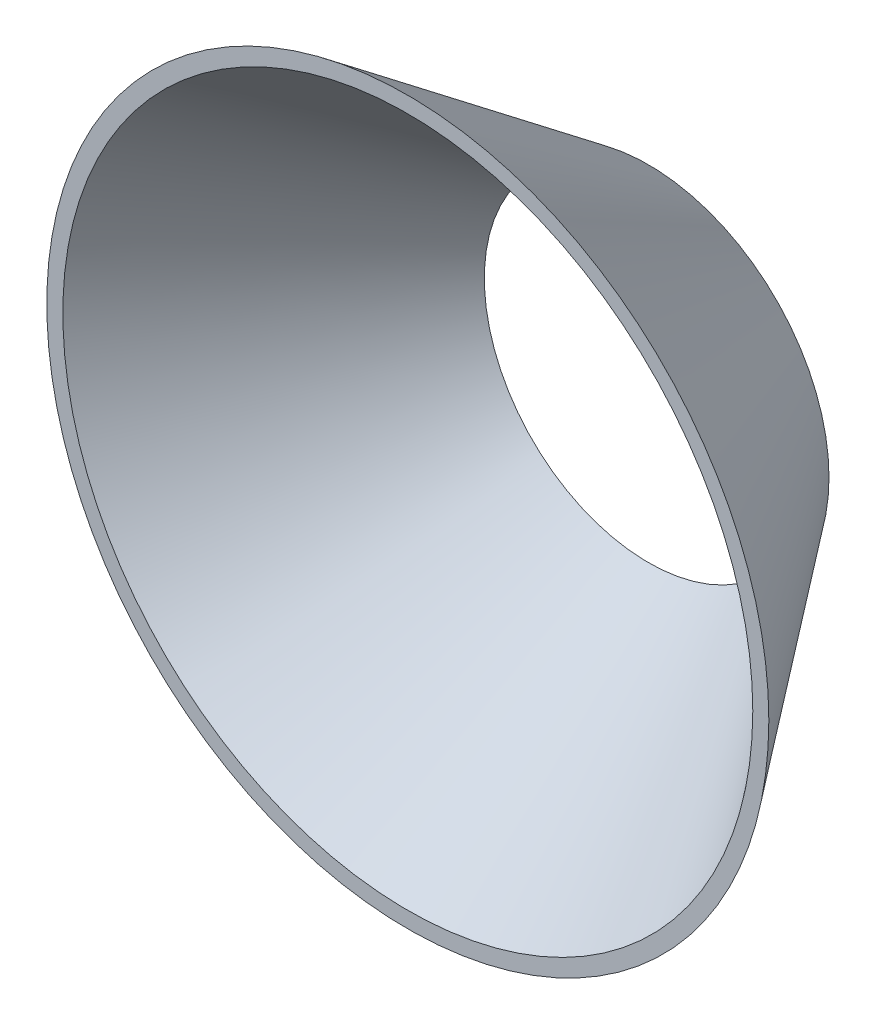
from build123d import *


with BuildPart() as part:
    # Sketch5 → Revolve2 (revolve)
    with BuildSketch(Plane(origin=(0, 0, 0), x_dir=(1, 0, 0), z_dir=(0, 1, 0)), mode=Mode.PRIVATE) as revolve2_sk:
        Polygon((-43, 0), (-20.46484551, 30), (-22.5, 30), (-45, 0), align=None)
    revolve(revolve2_sk.sketch.rotate(Axis((0, 0, 0), (0, 0, -1)), 180), axis=Axis((0, 0, 0), (0, 0, -1)))


solid = part.part
